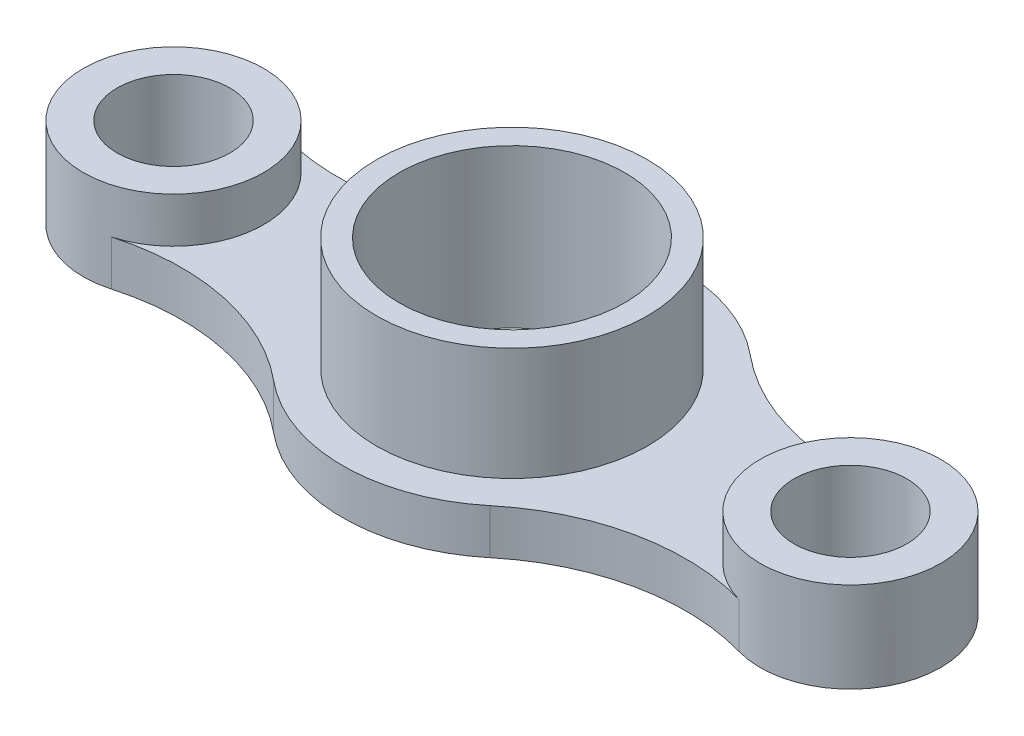
from build123d import *

# Parameters (mm, degrees)
SKETCH1_R           = 60
BOSS_EXTRUDE1_DEPTH = 20
SKETCH1_3_R         = 40
SKETCH1_3_R_2       = 25
BOSS_EXTRUDE2_DEPTH = 40
SKETCH1_4_R         = 60
SKETCH1_4_R_2       = 50
BOSS_EXTRUDE3_DEPTH = 70


with BuildPart() as part:
    # Sketch1 → Boss-Extrude1 (new body)
    with BuildSketch(Plane(origin=(0, 0, 0), x_dir=(1, 0, 0), z_dir=(0, 1, 0))):
        with BuildLine():
            ThreePointArc((-47.892857143, -57.717191847), (0, -75), (47.892857143, -57.717191847))
            ThreePointArc((47.892857143, -57.717191847), (91.104177178, -36.827906099), (139.071428571, -38.478127898))
            ThreePointArc((139.071428571, -38.478127898), (110, 0), (139.071428571, 38.478127898))
            ThreePointArc((139.071428571, 38.478127898), (91.104177178, 36.827906099), (47.892857143, 57.717191847))
            ThreePointArc((47.892857143, 57.717191847), (0, 75), (-47.892857143, 57.717191847))
            ThreePointArc((-47.892857143, 57.717191847), (-91.104177178, 36.827906099), (-139.071428571, 38.478127898))
            ThreePointArc((-139.071428571, 38.478127898), (-110, 0), (-139.071428571, -38.478127898))
            ThreePointArc((-139.071428571, -38.478127898), (-91.104177178, -36.827906099), (-47.892857143, -57.717191847))
        make_face()
        Circle(SKETCH1_R, mode=Mode.SUBTRACT)
    extrude(amount=BOSS_EXTRUDE1_DEPTH)

    # Sketch1<3> → Boss-Extrude2 (add)
    # profile 1 of 2: a face of its own
    with BuildSketch(Plane(origin=(0, 0, 0), x_dir=(1, 0, 0), z_dir=(0, 1, 0))):
        with Locations((-150, 0)):
            Circle(SKETCH1_3_R)
        with Locations((-150, 0)):
            Circle(SKETCH1_3_R_2, mode=Mode.SUBTRACT)
    # profile 2 of 2: a face of its own
    with BuildSketch(Plane(origin=(0, 0, 0), x_dir=(1, 0, 0), z_dir=(0, 1, 0))):
        with Locations((150, 0)):
            Circle(SKETCH1_3_R)
        with Locations((150, 0)):
            Circle(SKETCH1_3_R_2, mode=Mode.SUBTRACT)
    extrude(amount=BOSS_EXTRUDE2_DEPTH)

    # Sketch1<4> → Boss-Extrude3 (add)
    with BuildSketch(Plane(origin=(0, 0, 0), x_dir=(1, 0, 0), z_dir=(0, 1, 0))):
        Circle(SKETCH1_4_R)
        Circle(SKETCH1_4_R_2, mode=Mode.SUBTRACT)
    extrude(amount=BOSS_EXTRUDE3_DEPTH)


solid = part.part
